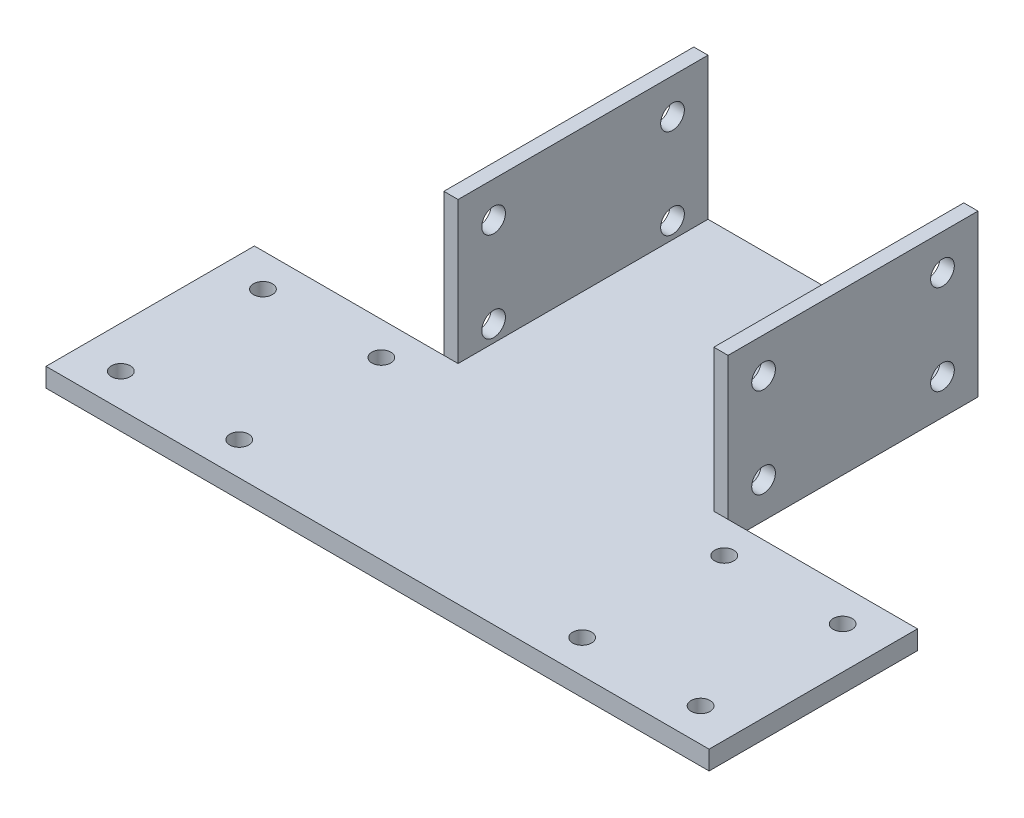
from build123d import *

# Parameters (mm, degrees)
SKETCH_1_R               = 2
EXTRUDE_1_DEPTH          = 4
SKETCH_1_3_W             = 3
SKETCH_1_3_H             = 52.773364798
EXTRUDE_2_DEPTH          = 34
CUT_EXTRUDE_1_DEPTH      = 174.554268557
CUT_EXTRUDE_1_DEPTH_BACK = 174.554268557
SKETCH_2_R               = 2.5


with BuildPart() as part:
    # 草图1 → 凸台-拉伸1 (new body)
    with BuildSketch(Plane(origin=(0, 0, 0), x_dir=(1, 0, 0), z_dir=(0, 1, 0))):
        Polygon((0, 0), (140, 0), (140, 44), (97, 44), (97, 96.773364798), (43, 96.773364798), (43, 44), (0, 44), align=None)
        with Locations((8.8, 7)):
            Circle(SKETCH_1_R, mode=Mode.SUBTRACT)
        with Locations((33.8, 7)):
            Circle(SKETCH_1_R, mode=Mode.SUBTRACT)
        with Locations((8.8, 37)):
            Circle(SKETCH_1_R, mode=Mode.SUBTRACT)
        with Locations((33.8, 37)):
            Circle(SKETCH_1_R, mode=Mode.SUBTRACT)
        with Locations((131.2, 37)):
            Circle(SKETCH_1_R, mode=Mode.SUBTRACT)
        with Locations((106.2, 37)):
            Circle(SKETCH_1_R, mode=Mode.SUBTRACT)
        with Locations((106.2, 7)):
            Circle(SKETCH_1_R, mode=Mode.SUBTRACT)
        with Locations((131.2, 7)):
            Circle(SKETCH_1_R, mode=Mode.SUBTRACT)
    extrude(amount=EXTRUDE_1_DEPTH)

    # 草图1<3> → 凸台-拉伸2 (add)
    with BuildSketch(Plane(origin=(0, 0, 0), x_dir=(1, 0, 0), z_dir=(0, 1, 0))):
        with Locations((41.5, 70.386682399)):
            Rectangle(SKETCH_1_3_W, SKETCH_1_3_H)
        with Locations((98.5, 70.386682399)):
            Rectangle(SKETCH_1_3_W, SKETCH_1_3_H)
    extrude(amount=EXTRUDE_2_DEPTH)

    # 草图2 → 切除-拉伸1 (cut, two sides: drawn at the far end of the back side and taken through both)
    with BuildSketch(Plane(origin=(0, 0, 0), x_dir=(0, 0, -1), z_dir=(1, 0, 0)).offset(-CUT_EXTRUDE_1_DEPTH_BACK)):
        with Locations((51.5, 7.5)):
            Circle(SKETCH_2_R)
        with Locations((89.273364798, 7.5)):
            Circle(SKETCH_2_R)
        with Locations((89.273364798, 26.5)):
            Circle(SKETCH_2_R)
        with Locations((51.5, 26.5)):
            Circle(SKETCH_2_R)
    extrude(amount=CUT_EXTRUDE_1_DEPTH + CUT_EXTRUDE_1_DEPTH_BACK, mode=Mode.SUBTRACT)


solid = part.part
